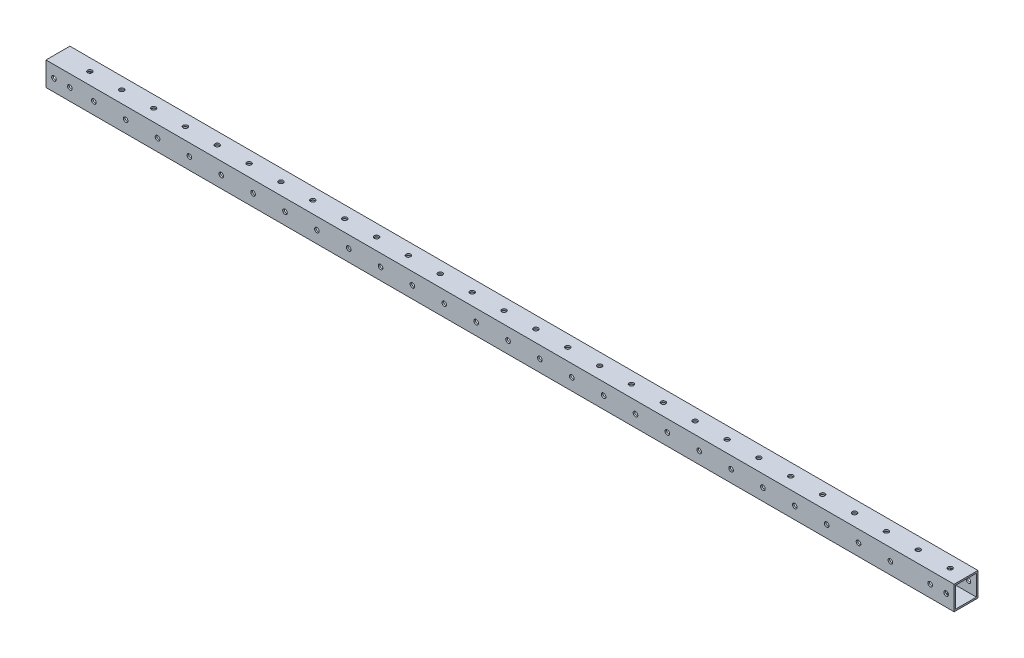
from build123d import *

# Parameters (mm, degrees)
SKETCH_1_W          = 15
SKETCH_1_H          = 15
SKETCH_1_W_2        = 13
SKETCH_1_H_2        = 13
EXTRUDE_1_DEPTH     = 570
SKETCH_2_R          = 1.45
CUT_EXTRUDE_1_DEPTH = 571.246657158
SKETCH_3_R          = 1.45
CUT_EXTRUDE_2_DEPTH = 571.246657158


with BuildPart() as part:
    # 草图1 → 凸台-拉伸1 (new body)
    with BuildSketch(Plane(origin=(0, 0, 0), x_dir=(0, 0, -1), z_dir=(1, 0, 0))):
        Rectangle(SKETCH_1_W, SKETCH_1_H)
        Rectangle(SKETCH_1_W_2, SKETCH_1_H_2, mode=Mode.SUBTRACT)
    extrude(amount=EXTRUDE_1_DEPTH)

    # 草图2 → 切除-拉伸1 (cut, through all)
    with BuildSketch(Plane(origin=(0, 7.5, 0), x_dir=(1, 0, 0), z_dir=(0, 1, 0))):
        with Locations(Location((20, 0, 0), (0, 0, 270))):
            Circle(SKETCH_2_R)
        with Locations(Location((40, 0, 0), (0, 0, 270))):
            Circle(SKETCH_2_R)
        with Locations(Location((60, 0, 0), (0, 0, 270))):
            Circle(SKETCH_2_R)
        with Locations(Location((80, 0, 0), (0, 0, 270))):
            Circle(SKETCH_2_R)
        with Locations(Location((100, 0, 0), (0, 0, 270))):
            Circle(SKETCH_2_R)
        with Locations(Location((120, 0, 0), (0, 0, 270))):
            Circle(SKETCH_2_R)
        with Locations(Location((140, 0, 0), (0, 0, 270))):
            Circle(SKETCH_2_R)
        with Locations(Location((160, 0, 0), (0, 0, 270))):
            Circle(SKETCH_2_R)
        with Locations(Location((180, 0, 0), (0, 0, 270))):
            Circle(SKETCH_2_R)
        with Locations(Location((200, 0, 0), (0, 0, 270))):
            Circle(SKETCH_2_R)
        with Locations(Location((220, 0, 0), (0, 0, 270))):
            Circle(SKETCH_2_R)
        with Locations(Location((240, 0, 0), (0, 0, 270))):
            Circle(SKETCH_2_R)
        with Locations(Location((260, 0, 0), (0, 0, 270))):
            Circle(SKETCH_2_R)
        with Locations(Location((280, 0, 0), (0, 0, 270))):
            Circle(SKETCH_2_R)
        with Locations(Location((300, 0, 0), (0, 0, 270))):
            Circle(SKETCH_2_R)
        with Locations(Location((320, 0, 0), (0, 0, 270))):
            Circle(SKETCH_2_R)
        with Locations(Location((340, 0, 0), (0, 0, 270))):
            Circle(SKETCH_2_R)
        with Locations(Location((360, 0, 0), (0, 0, 270))):
            Circle(SKETCH_2_R)
        with Locations(Location((380, 0, 0), (0, 0, 270))):
            Circle(SKETCH_2_R)
        with Locations(Location((400, 0, 0), (0, 0, 270))):
            Circle(SKETCH_2_R)
        with Locations(Location((420, 0, 0), (0, 0, 270))):
            Circle(SKETCH_2_R)
        with Locations(Location((440, 0, 0), (0, 0, 270))):
            Circle(SKETCH_2_R)
        with Locations(Location((460, 0, 0), (0, 0, 270))):
            Circle(SKETCH_2_R)
        with Locations(Location((480, 0, 0), (0, 0, 270))):
            Circle(SKETCH_2_R)
        with Locations(Location((500, 0, 0), (0, 0, 270))):
            Circle(SKETCH_2_R)
        with Locations(Location((520, 0, 0), (0, 0, 270))):
            Circle(SKETCH_2_R)
        with Locations(Location((540, 0, 0), (0, 0, 270))):
            Circle(SKETCH_2_R)
        with Locations(Location((560, 0, 0), (0, 0, 270))):
            Circle(SKETCH_2_R)
    extrude(amount=-CUT_EXTRUDE_1_DEPTH, mode=Mode.SUBTRACT)

    # 草图3 → 切除-拉伸2 (cut, through all)
    with BuildSketch(Plane.XY.offset(7.5)):
        with Locations((5, 0)):
            Circle(SKETCH_3_R)
        with Locations((15, 0)):
            Circle(SKETCH_3_R)
        with Locations((565, 0)):
            Circle(SKETCH_3_R)
        with Locations((555, 0)):
            Circle(SKETCH_3_R)
        with Locations((30, 0)):
            Circle(SKETCH_3_R)
        with Locations((50, 0)):
            Circle(SKETCH_3_R)
        with Locations((70, 0)):
            Circle(SKETCH_3_R)
        with Locations((90, 0)):
            Circle(SKETCH_3_R)
        with Locations((110, 0)):
            Circle(SKETCH_3_R)
        with Locations((130, 0)):
            Circle(SKETCH_3_R)
        with Locations((150, 0)):
            Circle(SKETCH_3_R)
        with Locations((170, 0)):
            Circle(SKETCH_3_R)
        with Locations((190, 0)):
            Circle(SKETCH_3_R)
        with Locations((210, 0)):
            Circle(SKETCH_3_R)
        with Locations((230, 0)):
            Circle(SKETCH_3_R)
        with Locations((250, 0)):
            Circle(SKETCH_3_R)
        with Locations((270, 0)):
            Circle(SKETCH_3_R)
        with Locations((290, 0)):
            Circle(SKETCH_3_R)
        with Locations((310, 0)):
            Circle(SKETCH_3_R)
        with Locations((330, 0)):
            Circle(SKETCH_3_R)
        with Locations((350, 0)):
            Circle(SKETCH_3_R)
        with Locations((370, 0)):
            Circle(SKETCH_3_R)
        with Locations((390, 0)):
            Circle(SKETCH_3_R)
        with Locations((410, 0)):
            Circle(SKETCH_3_R)
        with Locations((430, 0)):
            Circle(SKETCH_3_R)
        with Locations((450, 0)):
            Circle(SKETCH_3_R)
        with Locations((470, 0)):
            Circle(SKETCH_3_R)
        with Locations((490, 0)):
            Circle(SKETCH_3_R)
        with Locations((510, 0)):
            Circle(SKETCH_3_R)
        with Locations((530, 0)):
            Circle(SKETCH_3_R)
    extrude(amount=-CUT_EXTRUDE_2_DEPTH, mode=Mode.SUBTRACT)


solid = part.part
